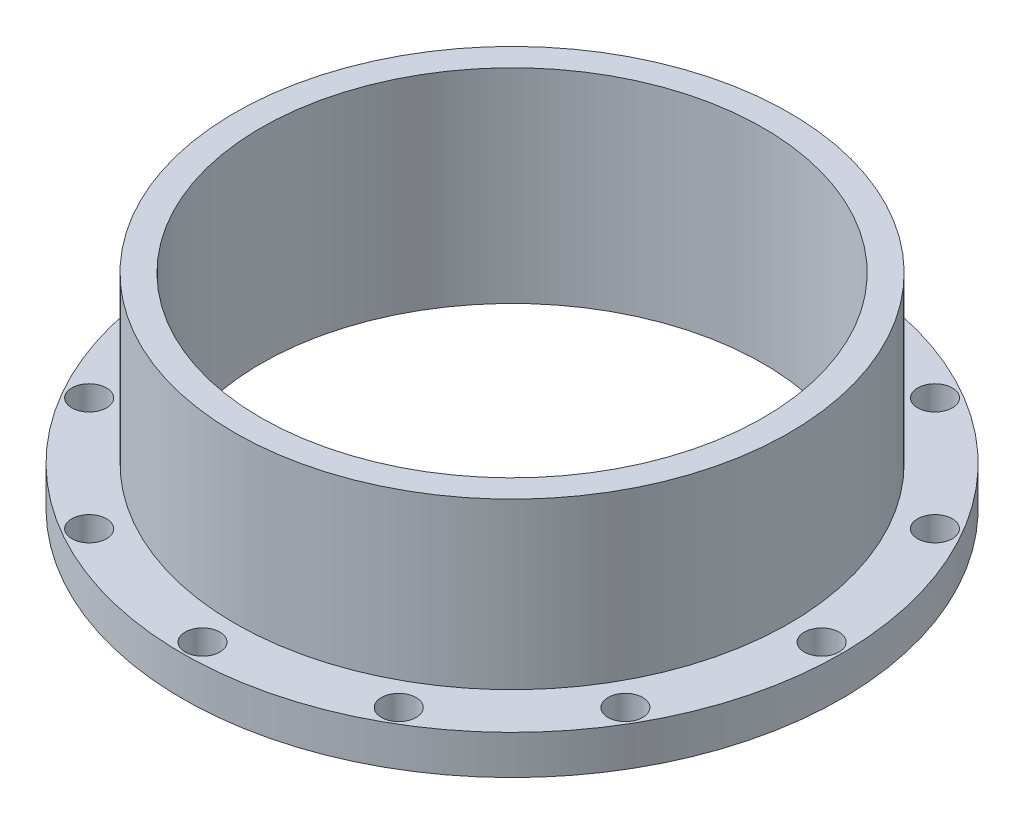
from build123d import *

# Parameters (mm, degrees)
SKETCH4_R                  = 49.2125
BOSS_EXTRUDE2_DEPTH        = 30.48
SKETCH5_OUTSIDE_W          = 128.922
SKETCH5_OUTSIDE_H          = 128.922
SKETCH5_OUTSIDE_R          = 41.402
CUT_EXTRUDE3_DEPTH         = 24.638
SKETCH6_R                  = 37.5
CUT_EXTRUDE4_DEPTH         = 76.978751717
F_6_0_204_DIAMETER_HOLE2_D = 5.1816
CIRPATTERN5_COUNT          = 12


with BuildPart() as part:
    # Sketch4 → Boss-Extrude2 (new body)
    with BuildSketch(Plane(origin=(0, 0, 0), x_dir=(1, 0, 0), z_dir=(0, 1, 0))):
        with Locations(Location((0, 0, 0), (0, 0, 90))):
            Circle(SKETCH4_R)
    extrude(amount=BOSS_EXTRUDE2_DEPTH)

    # Sketch5 outside → Cut-Extrude3 (cut)
    with BuildSketch(Plane(origin=(0, 30.48, 0), x_dir=(1, 0, 0), z_dir=(0, 1, 0))):
        Rectangle(SKETCH5_OUTSIDE_W, SKETCH5_OUTSIDE_H)
        with Locations(Location((0, 0, 0), (0, 0, 270))):
            Circle(SKETCH5_OUTSIDE_R, mode=Mode.SUBTRACT)
    extrude(amount=-CUT_EXTRUDE3_DEPTH, mode=Mode.SUBTRACT)

    # Sketch6 → Cut-Extrude4 (cut, through all)
    with BuildSketch(Plane(origin=(0, 30.48, 0), x_dir=(1, 0, 0), z_dir=(0, 1, 0))):
        with Locations(Location((0, 0, 0), (0, 0, 270))):
            Circle(SKETCH6_R)
    extrude(amount=-CUT_EXTRUDE4_DEPTH, mode=Mode.SUBTRACT)

    # #6 (0.204) Diameter Hole2 (through all)
    with Locations(Plane(origin=(0, 5.842, 0), x_dir=(1, 0, 0), z_dir=(0, 1, 0))):
        with Locations((0, 46.228)):
            f_6_0_204_diameter_hole2 = Hole(F_6_0_204_DIAMETER_HOLE2_D / 2)

    # CirPattern5: #6 (0.204) Diameter Hole2 ×12 about axis
    cirpattern5_axis = Axis((0, 0, 0), (0, 1, 0))
    for i in range(1, CIRPATTERN5_COUNT):
        add(f_6_0_204_diameter_hole2.rotate(cirpattern5_axis, i * 360 / CIRPATTERN5_COUNT), mode=Mode.SUBTRACT)


solid = part.part
